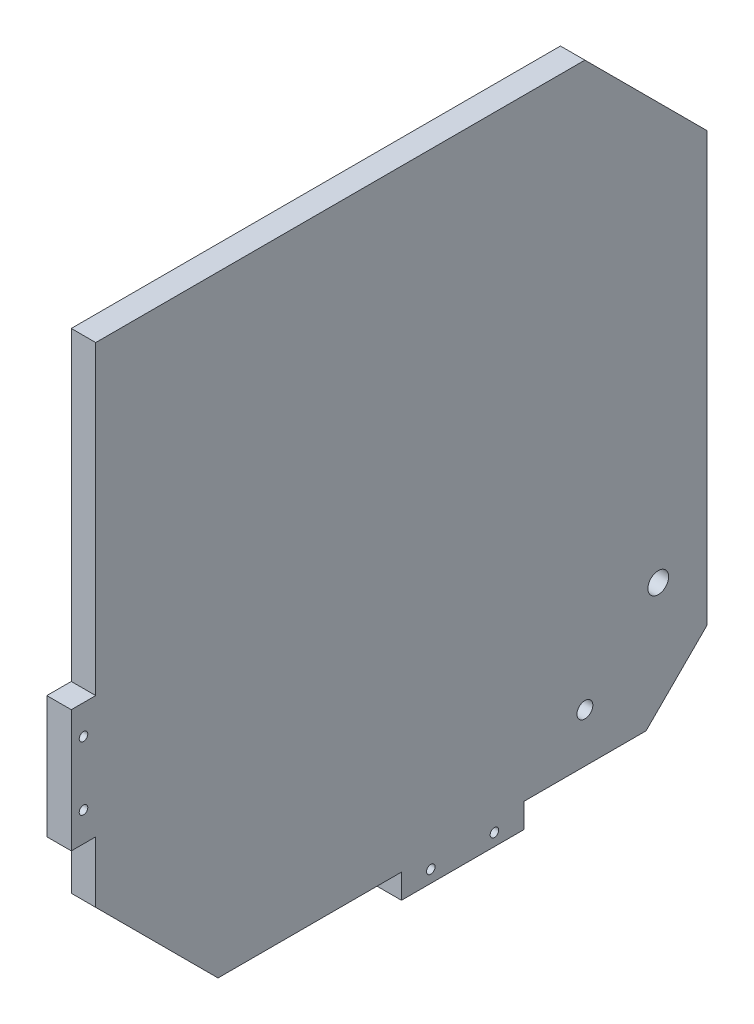
from build123d import *

# Parameters (mm, degrees)
SKETCH1_R           = 1.75
BOSS_EXTRUDE1_DEPTH = 10
SKETCH2_R           = 1.5
CUT_EXTRUDE1_DEPTH  = 15
SKETCH3_R           = 4.25
SKETCH3_R_2         = 3.25
CUT_EXTRUDE2_DEPTH  = 354.694783677


with BuildPart() as part:
    # Sketch1 → Boss-Extrude1 (new body)
    with BuildSketch(Plane(origin=(0, 0, 0), x_dir=(0, 0, -1), z_dir=(1, 0, 0))):
        Polygon((50, 0), (125, 0), (125, -10), (175, -10), (175, 0), (225, 0), (250, 25), (250, 200), (200, 250), (0, 250), (0, 125), (-10, 125), (-10, 75), (0, 75), (0, 50), align=None)
        with Locations((-5, 113)):
            Circle(SKETCH1_R, mode=Mode.SUBTRACT)
        with Locations((-5, 87)):
            Circle(SKETCH1_R, mode=Mode.SUBTRACT)
        with Locations((137, -5)):
            Circle(SKETCH1_R, mode=Mode.SUBTRACT)
        with Locations((163, -5)):
            Circle(SKETCH1_R, mode=Mode.SUBTRACT)
    extrude(amount=BOSS_EXTRUDE1_DEPTH)

    # Sketch2 → Cut-Extrude1 (cut)
    with BuildSketch(Plane(origin=(0, 225, -225), x_dir=(1, 0, 0), z_dir=(0, 0.7071067811865477, -0.7071067811865475))):
        with Locations(Location((5, 4.644660941, 0), (0, 0, 270))):
            Circle(SKETCH2_R)
        with Locations(Location((5, -25.355339059, 0), (0, 0, 270))):
            Circle(SKETCH2_R)
    extrude(amount=-CUT_EXTRUDE1_DEPTH, mode=Mode.SUBTRACT)

    # Sketch3 → Cut-Extrude2 (cut, through all)
    with BuildSketch(Plane(origin=(10, 0, 0), x_dir=(0, 0, -1), z_dir=(1, 0, 0))):
        with Locations((230, 50)):
            Circle(SKETCH3_R)
        with Locations((200, 20)):
            Circle(SKETCH3_R_2)
    extrude(amount=-CUT_EXTRUDE2_DEPTH, mode=Mode.SUBTRACT)


solid = part.part
